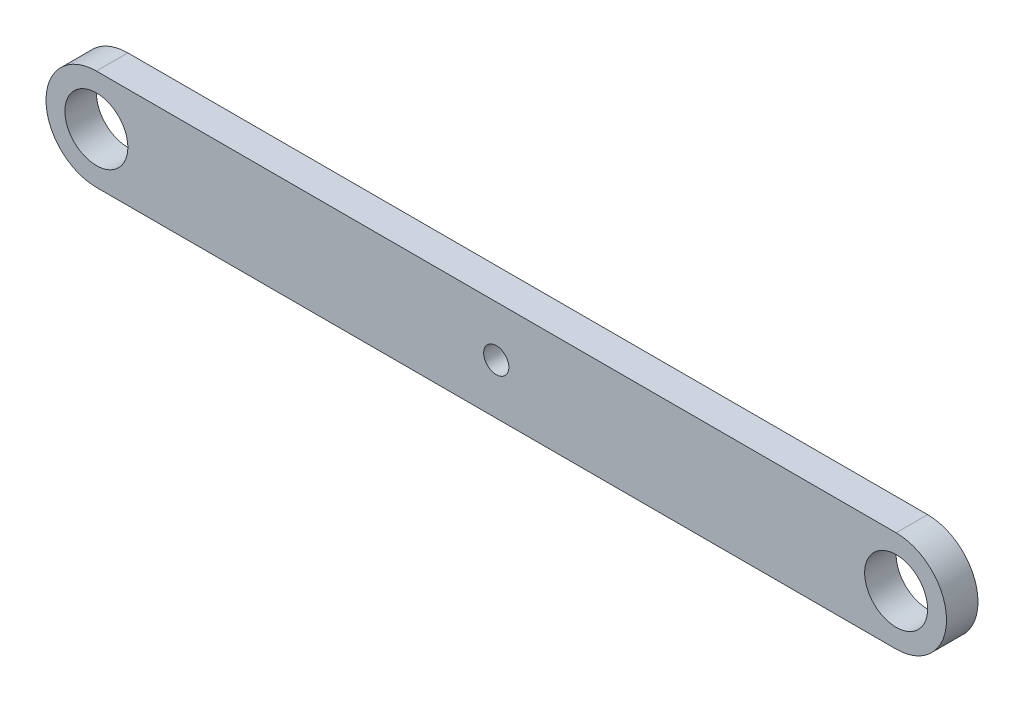
from build123d import *

# Parameters (mm, degrees)
SKETCH1_R           = 5
SKETCH1_R_2         = 2
BOSS_EXTRUDE1_DEPTH = 2.5


with BuildPart() as part:
    # Sketch1 → Boss-Extrude1 (new, symmetric)
    with BuildSketch(Plane.XY):
        with BuildLine():
            Line((-63.5, 8), (63.5, 8))
            ThreePointArc((63.5, 8), (71.5, 0), (63.5, -8))
            Line((63.5, -8), (-63.5, -8))
            ThreePointArc((-63.5, -8), (-71.5, 0), (-63.5, 8))
        make_face()
        with Locations((-63.5, 0)):
            Circle(SKETCH1_R, mode=Mode.SUBTRACT)
        with Locations((63.5, 0)):
            Circle(SKETCH1_R, mode=Mode.SUBTRACT)
        Circle(SKETCH1_R_2, mode=Mode.SUBTRACT)
    extrude(amount=BOSS_EXTRUDE1_DEPTH, both=True)


solid = part.part
